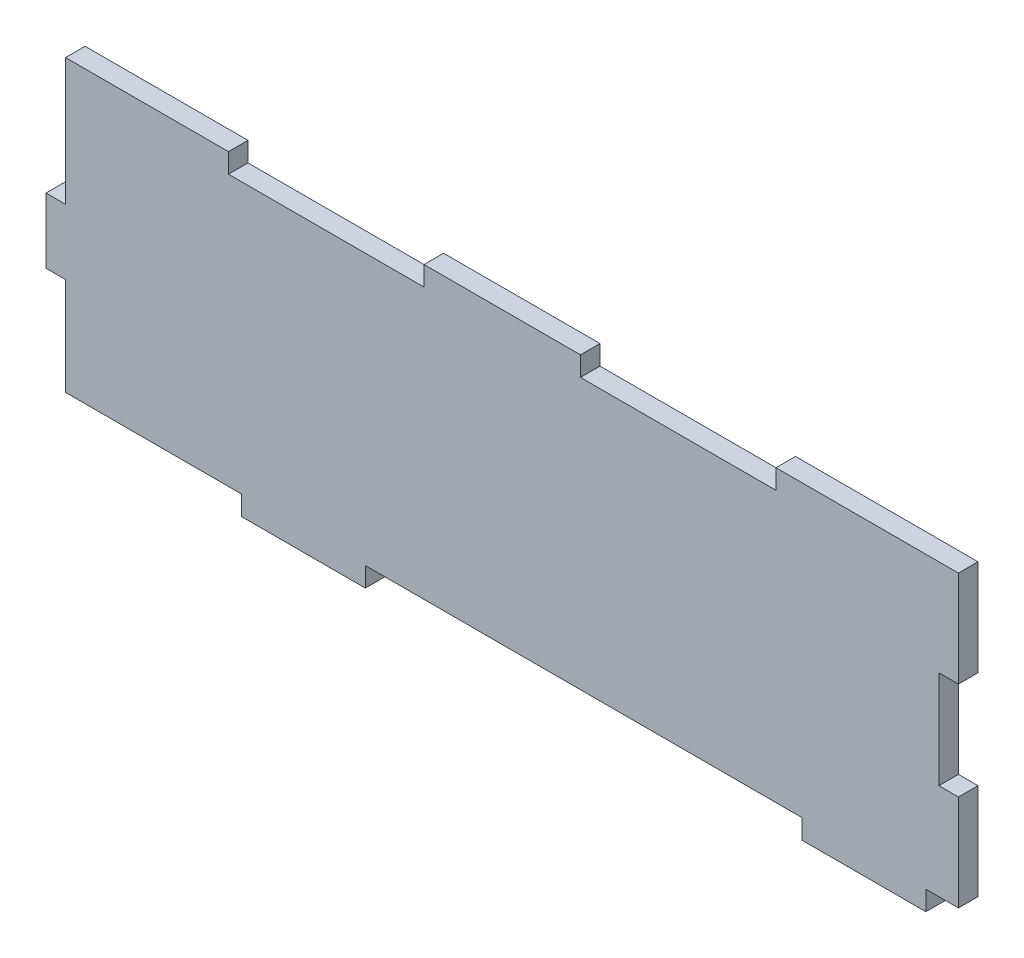
from build123d import *

# Parameters (mm, degrees)
ESQUISSE1_W             = 330
ESQUISSE1_H             = 75
BOSS_EXTRU_1_DEPTH      = 6
ESQUISSE2_W             = 134
ESQUISSE2_H             = 6
ESQUISSE2_W_2           = 6
ESQUISSE2_H_2           = 19
ESQUISSE2_H_3           = 29
ENL_V_MAT_EXTRU_1_DEPTH = 6
ESQUISSE3_W             = 50
ESQUISSE3_H             = 6
BOSS_EXTRU_2_DEPTH      = 70
ESQUISSE5_W             = 6
ESQUISSE5_H             = 40
BOSS_EXTRU_3_DEPTH      = 6
ESQUISSE6_W             = 268
ESQUISSE6_H             = 6
BOSS_EXTRU_4_DEPTH      = 20
ESQUISSE7_W             = 58.270575025
ESQUISSE7_H             = 148.089415769
ESQUISSE7_W_2           = 60
ESQUISSE7_H_2           = 6
ENL_V_MAT_EXTRU_3_DEPTH = 361.50104022
ESQUISSE8_W             = 6
ESQUISSE8_H             = 29.5
BOSS_EXTRU_5_DEPTH      = 6


with BuildPart() as part:
    # Esquisse1 → Boss.-Extru.1 (new body)
    with BuildSketch(Plane.XY):
        with Locations((-165, 37.5)):
            Rectangle(ESQUISSE1_W, ESQUISSE1_H)
    extrude(amount=BOSS_EXTRU_1_DEPTH)

    # Esquisse2 → Enlèv. mat.-Extru.1 (cut)
    with BuildSketch(Plane.XY.offset(6)):
        Polygon((-330, 0), (-270, 0), (-270, 6), (-324, 6), (-324, 36), (-330, 36), align=None)
        Polygon((0, 0), (-60, 0), (-60, 6), (-6, 6), (-6, 26), (0, 26), align=None)
        with Locations((-165, 3)):
            Rectangle(ESQUISSE2_W, ESQUISSE2_H)
        with Locations((-327, 65.5)):
            Rectangle(ESQUISSE2_W_2, ESQUISSE2_H_2)
        with Locations((-3, 60.5)):
            Rectangle(ESQUISSE2_W_2, ESQUISSE2_H_3)
    extrude(amount=-ENL_V_MAT_EXTRU_1_DEPTH, mode=Mode.SUBTRACT)

    # Esquisse3 → Boss.-Extru.2 (add)
    with BuildSketch(Plane(origin=(0, 75, 0), x_dir=(1, 0, 0), z_dir=(0, 1, 0))):
        with Locations((-31, -3)):
            Rectangle(ESQUISSE3_W, ESQUISSE3_H)
    extrude(amount=BOSS_EXTRU_2_DEPTH)

    # Esquisse5 → Boss.-Extru.3 (add)
    with BuildSketch(Plane(origin=(-6, 0, 0), x_dir=(0, 0, -1), z_dir=(1, 0, 0))):
        with Locations((-3, 105)):
            Rectangle(ESQUISSE5_W, ESQUISSE5_H)
    extrude(amount=BOSS_EXTRU_3_DEPTH)

    # Esquisse6 → Boss.-Extru.4 (add)
    with BuildSketch(Plane(origin=(0, 75, 0), x_dir=(1, 0, 0), z_dir=(0, 1, 0))):
        with Locations((-190, -3)):
            Rectangle(ESQUISSE6_W, ESQUISSE6_H)
    extrude(amount=BOSS_EXTRU_4_DEPTH)

    # Esquisse7 → Enlèv. mat.-Extru.3 (cut, through all)
    with BuildSketch(Plane.XY.offset(6)):
        with Locations((-26.864712488, 70.955292116)):
            Rectangle(ESQUISSE7_W, ESQUISSE7_H)
        with Locations((-136, 92)):
            Rectangle(ESQUISSE7_W_2, ESQUISSE7_H_2)
        with Locations((-244, 92)):
            Rectangle(ESQUISSE7_W_2, ESQUISSE7_H_2)
    extrude(amount=-ENL_V_MAT_EXTRU_3_DEPTH, mode=Mode.SUBTRACT)

    # Esquisse8 → Boss.-Extru.5 (add)
    with BuildSketch(Plane(origin=(-56, 0, 0), x_dir=(0, 0, -1), z_dir=(1, 0, 0))):
        with Locations((-3, 20.75)):
            Rectangle(ESQUISSE8_W, ESQUISSE8_H)
        with Locations((-3, 80.25)):
            Rectangle(ESQUISSE8_W, ESQUISSE8_H)
    extrude(amount=BOSS_EXTRU_5_DEPTH)


solid = part.part
